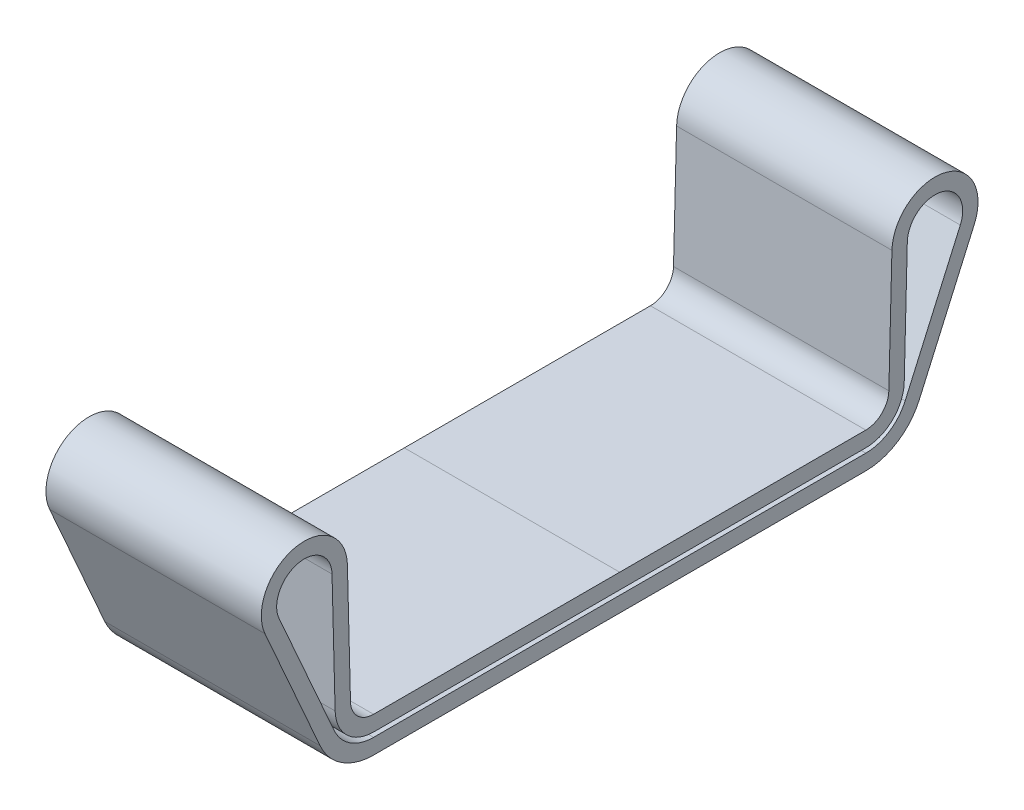
from build123d import *

# Parameters (mm, degrees)
BOSS_EXTRUDE1_DEPTH = 7


with BuildPart() as part:
    # Sketch1 → Boss-Extrude1 (new, symmetric)
    with BuildSketch(Plane(origin=(0, 0, 0), x_dir=(0, 0, -1), z_dir=(1, 0, 0))):
        with BuildLine():
            Line((-22.14614181, 6.771839894), (-18.561151485, -1.33269977))
            ThreePointArc((-18.561151485, -1.33269977), (-17.528308744, -2.546439623), (-16.000496078, -3))
            Line((-16.000496078, -3), (0, -3))
            Line((0, -3), (0, -4))
            Line((0, -4), (-16.000496078, -4))
            ThreePointArc((-16.000496078, -4), (-18.073958177, -3.384453165), (-19.475674713, -1.737233163))
            Line((-19.475674713, -1.737233163), (-23.060665038, 6.367306501))
            ThreePointArc((-23.060665038, 6.367306501), (-21.114031535, 10.231842835), (-17.700926013, 7.572005665))
            Line((-17.700926013, 7.572005665), (-17.5, -0.238584995))
            ThreePointArc((-17.5, -0.238584995), (-17.047428938, -1.274222609), (-16.000495091, -1.700010532))
            Line((-16.000495091, -1.700010532), (0, -1.7))
            Line((0, -1.7), (0, -2.7))
            Line((0, -2.7), (-16.000494433, -2.700010532))
            ThreePointArc((-16.000494433, -2.700010532), (-17.745384177, -1.990363995), (-18.499669281, -0.264301304))
            Line((-18.499669281, -0.264301304), (-18.700595294, 7.546289356))
            ThreePointArc((-18.700595294, 7.546289356), (-20.894734558, 9.25618468), (-22.14614181, 6.771839894))
        make_face()
    boss_extrude1 = extrude(amount=BOSS_EXTRUDE1_DEPTH, both=True)

    # Mirror1: Boss-Extrude1 across plane
    add(boss_extrude1.mirror(Plane.XY))


solid = part.part
